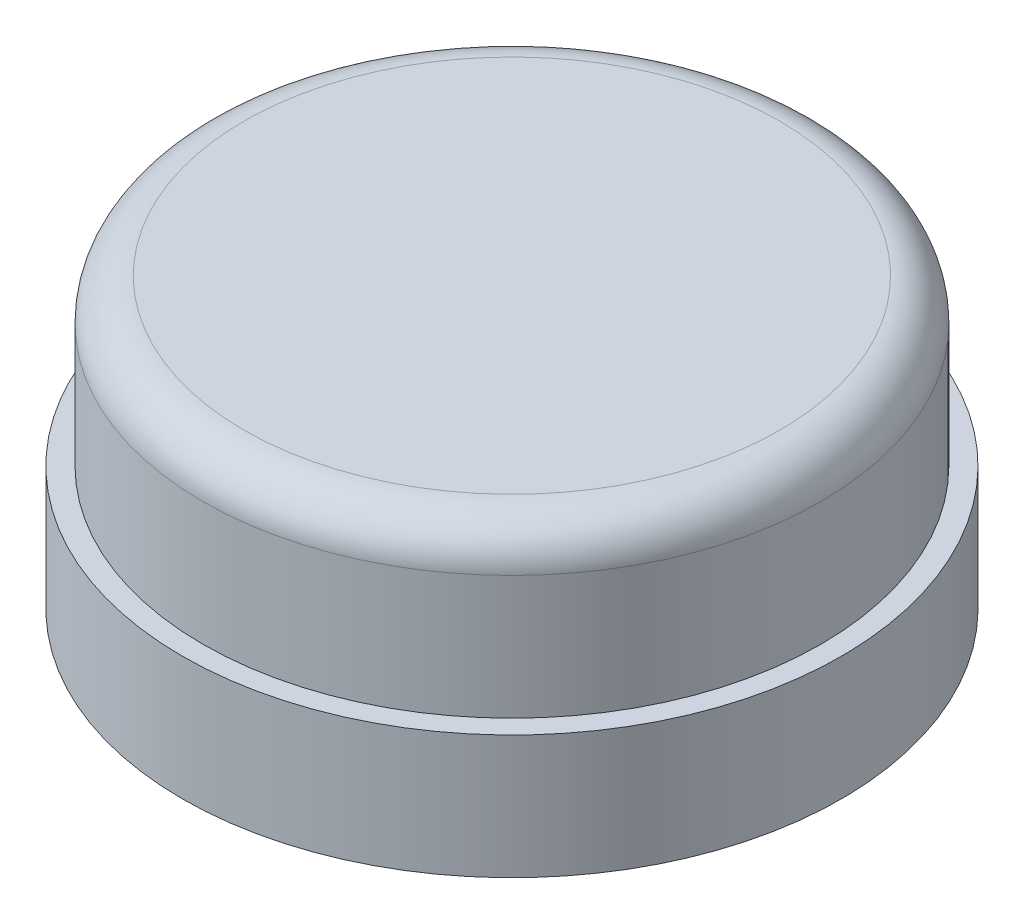
from build123d import *

# Parameters (mm, degrees)
SKETCH1_R           = 8
BOSS_EXTRUDE1_DEPTH = 3
SKETCH2_R           = 7.5
BOSS_EXTRUDE2_DEPTH = 4
FILLET1_R           = 1


with BuildPart() as part:
    # Sketch1 → Boss-Extrude1 (new body)
    with BuildSketch(Plane(origin=(0, 0, 0), x_dir=(1, 0, 0), z_dir=(0, 1, 0))):
        with Locations(Location((0, 0, 0), (0, 0, 270))):
            Circle(SKETCH1_R)
    extrude(amount=BOSS_EXTRUDE1_DEPTH)

    # Sketch2 → Boss-Extrude2 (add)
    with BuildSketch(Plane(origin=(0, 3, 0), x_dir=(1, 0, 0), z_dir=(0, 1, 0))):
        with Locations(Location((0, 0, 0), (0, 0, 270))):
            Circle(SKETCH2_R)
    extrude(amount=BOSS_EXTRUDE2_DEPTH)

    # Fillet1
    fillet1_edges = [part.edges().sort_by_distance(p)[0] for p in [
        (0, 7, -7.5),
    ]]
    fillet(fillet1_edges, radius=FILLET1_R)


solid = part.part
